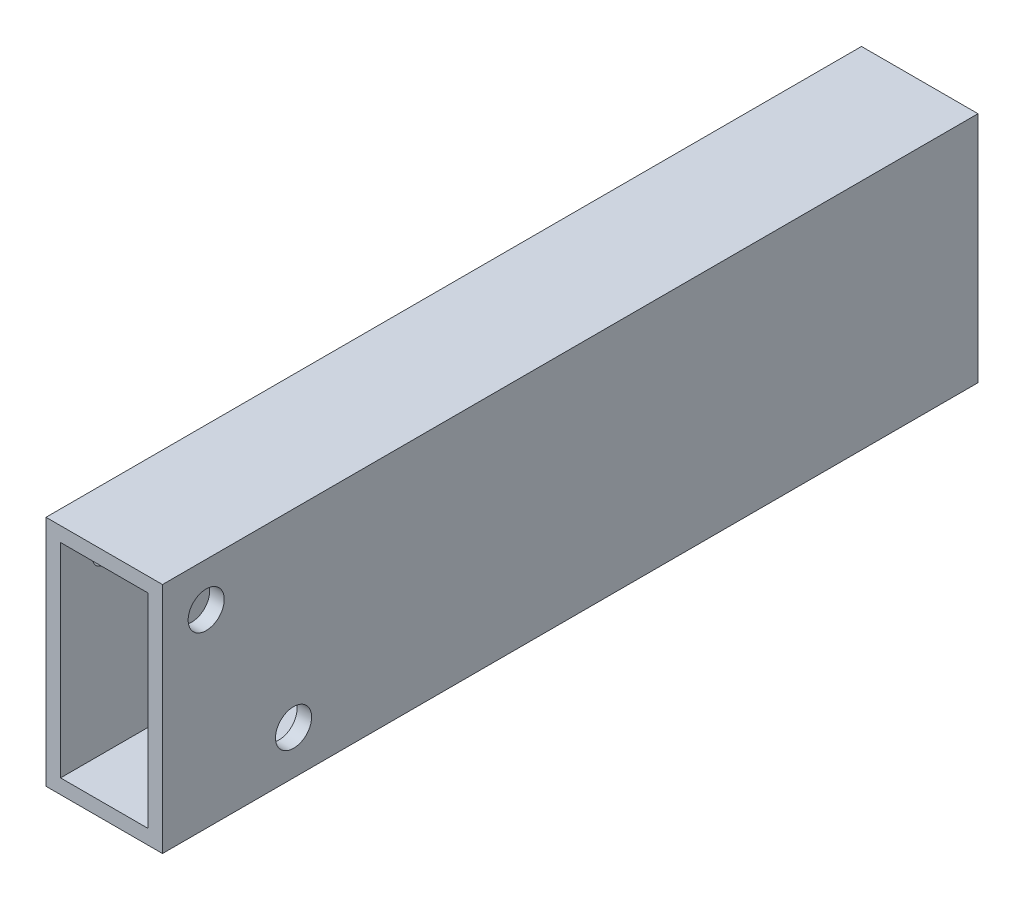
from build123d import *

# Parameters (mm, degrees)
SKETCH1_W           = 25.4
SKETCH1_H           = 50.8
SKETCH1_W_2         = 19.05
SKETCH1_H_2         = 44.45
BOSS_EXTRUDE1_DEPTH = 177.8
SKETCH2_R           = 2.5796875
CUT_EXTRUDE1_DEPTH  = 182.392282085
CUT_EXTRUDE2_REACH  = 183.392
SKETCH3_R           = 3.937


with BuildPart() as part:
    # Sketch1 → Boss-Extrude1 (new body)
    with BuildSketch(Plane.XY):
        Rectangle(SKETCH1_W, SKETCH1_H)
        Rectangle(SKETCH1_W_2, SKETCH1_H_2, mode=Mode.SUBTRACT)
    extrude(amount=BOSS_EXTRUDE1_DEPTH)

    # Sketch2 → Cut-Extrude1 (cut, through all)
    with BuildSketch(Plane(origin=(12.7, 0, 0), x_dir=(0, 0, -1), z_dir=(1, 0, 0))):
        with Locations((-168.275, 15.875)):
            Circle(SKETCH2_R)
        with Locations((-149.225, -15.875)):
            Circle(SKETCH2_R)
    extrude(amount=-CUT_EXTRUDE1_DEPTH, mode=Mode.SUBTRACT)

    # Sketch3 → Cut-Extrude2 (cut, up to next)
    with BuildSketch(Plane(origin=(12.7, 0, 0), x_dir=(0, 0, -1), z_dir=(1, 0, 0)), mode=Mode.PRIVATE) as cut_extrude2_sk1:
        with Locations((-168.275, 15.875)):
            Circle(SKETCH3_R)
    cut_extrude2_tool1 = extrude(cut_extrude2_sk1.sketch, amount=-CUT_EXTRUDE2_REACH, mode=Mode.PRIVATE) & part.part
    # Sketch3 → Cut-Extrude2 (cut, up to next)
    with BuildSketch(Plane(origin=(12.7, 0, 0), x_dir=(0, 0, -1), z_dir=(1, 0, 0)), mode=Mode.PRIVATE) as cut_extrude2_sk2:
        with Locations((-149.225, -15.875)):
            Circle(SKETCH3_R)
    cut_extrude2_tool2 = extrude(cut_extrude2_sk2.sketch, amount=-CUT_EXTRUDE2_REACH, mode=Mode.PRIVATE) & part.part
    add(cut_extrude2_tool1.solids().sort_by_distance((12.7, 15.875, 168.275))[0], mode=Mode.SUBTRACT)
    add(cut_extrude2_tool2.solids().sort_by_distance((12.7, -15.875, 149.225))[0], mode=Mode.SUBTRACT)


solid = part.part
